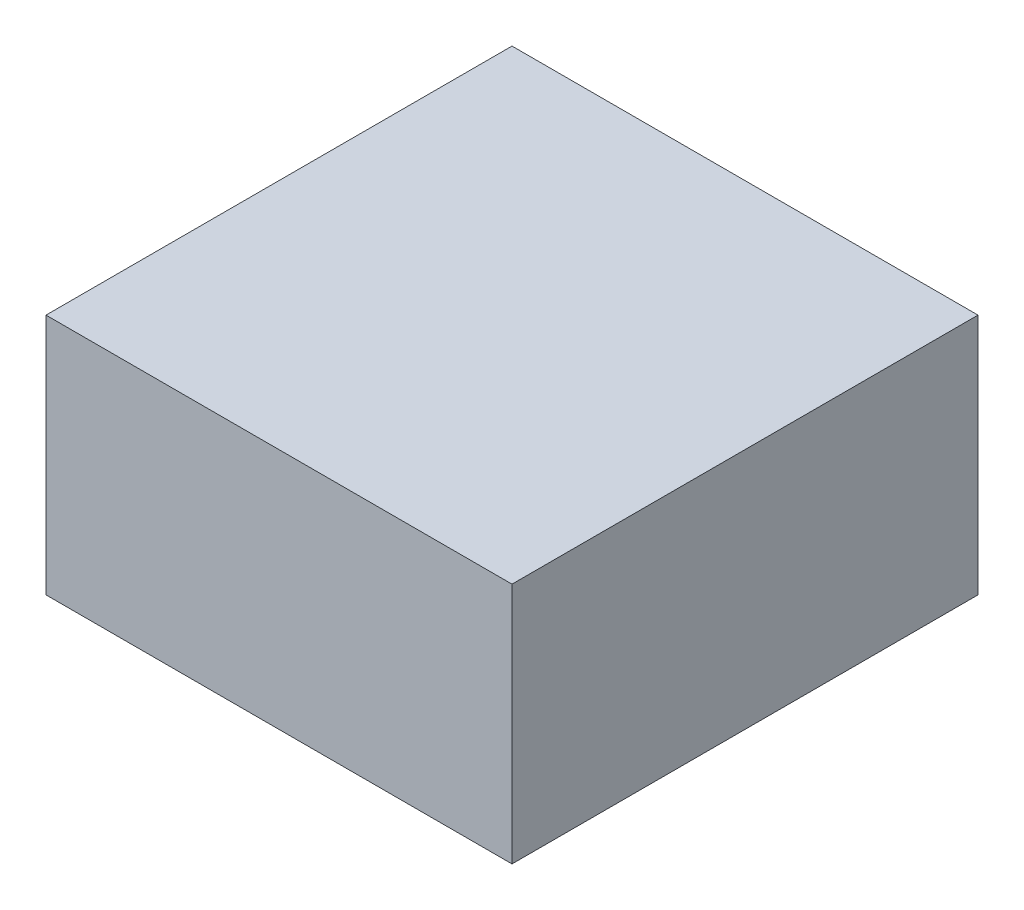
from build123d import *

# Parameters (mm, degrees)
SKETCH1_W           = 127
SKETCH1_H           = 127
BOSS_EXTRUDE1_DEPTH = 66.04


with BuildPart() as part:
    # Sketch1 → Boss-Extrude1 (new body)
    with BuildSketch(Plane(origin=(0, 0, 0), x_dir=(1, 0, 0), z_dir=(0, 1, 0))):
        with Locations((20.315846295, 18.264947237)):
            Rectangle(SKETCH1_W, SKETCH1_H)
    extrude(amount=BOSS_EXTRUDE1_DEPTH)


solid = part.part
